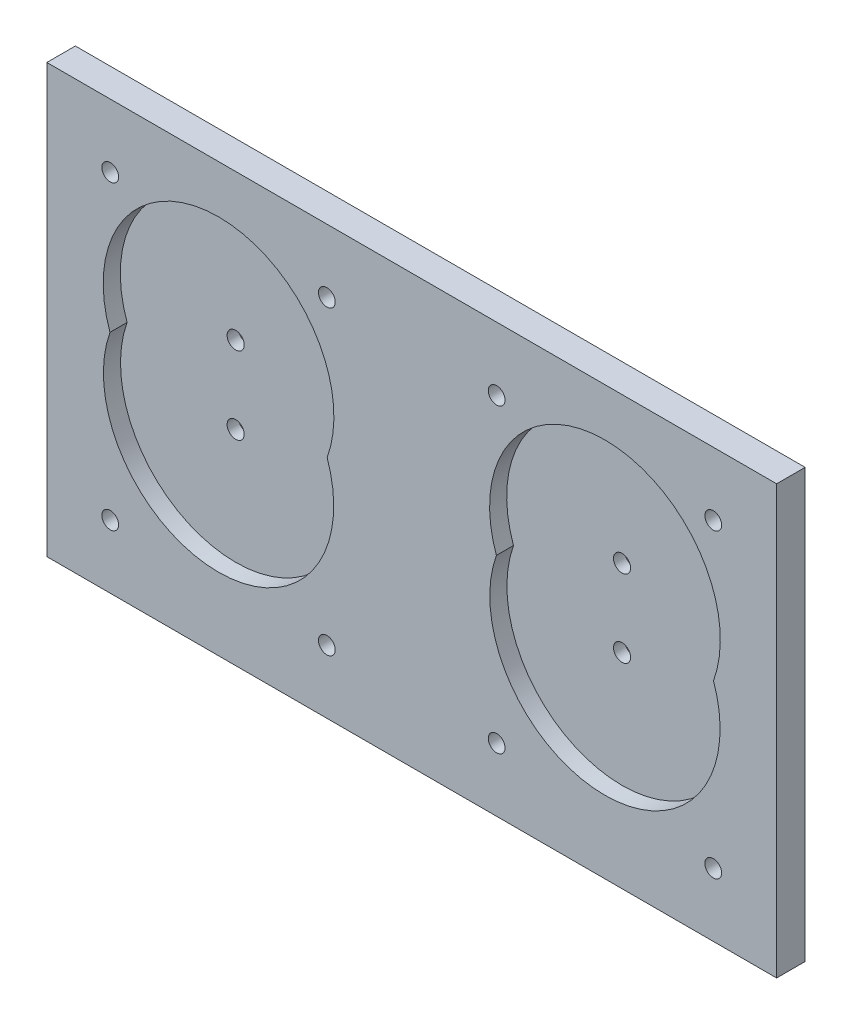
from build123d import *

# Parameters (mm, degrees)
SKETCH1_W           = 64.012274628
SKETCH1_H           = 75.085000506
BOSS_EXTRUDE1_DEPTH = 5
SKETCH7_R           = 1.4732
CUT_EXTRUDE1_DEPTH  = 10
SKETCH8_R           = 1.5
BOSS_EXTRUDE2_DEPTH = 2


with BuildPart() as part:
    # Sketch1 → Boss-Extrude1 (new body)
    # profile 1 of 2: a face of its own
    with BuildSketch(Plane.XY):
        with Locations((61.398411242, 7.077500224)):
            Rectangle(SKETCH1_W, SKETCH1_H)
        with BuildLine():
            ThreePointArc((83.484398078, 2.429730903), (59.871437613, -17.479677368), (44.238109553, 9.157805497))
            ThreePointArc((44.238109553, 9.157805497), (59.81501285, 35.930775127), (83.520814038, 15.994205484))
            ThreePointArc((83.520814038, 15.994205484), (83.22114917, 12.52456978), (82.331029644, 9.157693158))
            ThreePointArc((82.331029644, 9.157693158), (83.193968093, 5.842784333), (83.484398078, 2.429730903))
        make_face(mode=Mode.SUBTRACT)
    # profile 2 of 2: a face of its own
    with BuildSketch(Plane.XY):
        with Locations((-2.613863386, 7.077500224)):
            Rectangle(SKETCH1_W, SKETCH1_H)
        with BuildLine():
            ThreePointArc((15.69984642, 2.429730903), (-7.913055331, -17.479687433), (-23.546481788, 9.157693158))
            ThreePointArc((-23.546481788, 9.157693158), (-7.969677608, 35.930764895), (15.736182375, 15.994205484))
            ThreePointArc((15.736182375, 15.994205484), (15.436527739, 12.524628574), (14.546438303, 9.157805497))
            ThreePointArc((14.546438303, 9.157805497), (15.409406369, 5.842843047), (15.69984642, 2.429730903))
        make_face(mode=Mode.SUBTRACT)
    extrude(amount=BOSS_EXTRUDE1_DEPTH)

    # Sketch7 → Cut-Extrude1 (cut)
    with BuildSketch(Plane.XY.offset(5)):
        with Locations((-23.500584488, 33.499560055)):
            Circle(SKETCH7_R)
        with Locations((14.49941543, 33.50027263)):
            Circle(SKETCH7_R)
        with Locations((-23.49959354, -19.345440441)):
            Circle(SKETCH7_R)
        with Locations((14.500406379, -19.344727866)):
            Circle(SKETCH7_R)
        with Locations((44.284829686, -19.345328379)):
            Circle(SKETCH7_R)
        with Locations((44.284150424, 33.499672122)):
            Circle(SKETCH7_R)
        with Locations((82.284150347, 33.500160568)):
            Circle(SKETCH7_R)
        with Locations((82.284829608, -19.344839933)):
            Circle(SKETCH7_R)
    extrude(amount=-CUT_EXTRUDE1_DEPTH, mode=Mode.SUBTRACT)

    # Sketch8 → Boss-Extrude2 (add)
    # profile 1 of 2: a face of its own
    with BuildSketch(Plane(origin=(0, 0, 0), x_dir=(-1, 0, 0), z_dir=(0, 0, -1))):
        with BuildLine():
            ThreePointArc((-44.238109553, 9.157805497), (-63.284649438, 36.230429762), (-82.331029644, 9.157693158))
            ThreePointArc((-82.331029644, 9.157693158), (-63.284490186, -17.770117418), (-44.238109553, 9.157805497))
        make_face()
        with Locations((-63.284549757, 2.429730903)):
            Circle(SKETCH8_R, mode=Mode.SUBTRACT)
        with Locations((-63.28458976, 15.994205484)):
            Circle(SKETCH8_R, mode=Mode.SUBTRACT)
    # profile 2 of 2: a face of its own
    with BuildSketch(Plane(origin=(0, 0, 0), x_dir=(-1, 0, 0), z_dir=(0, 0, -1))):
        with BuildLine():
            ThreePointArc((23.546481788, 9.157693158), (4.500101582, 36.230429762), (-14.546438303, 9.157805497))
            ThreePointArc((-14.546438303, 9.157805497), (4.49994233, -17.770117418), (23.546481788, 9.157693158))
        make_face()
        with Locations((4.500041904, 15.994205484)):
            Circle(SKETCH8_R, mode=Mode.SUBTRACT)
        with Locations((4.500001901, 2.429730903)):
            Circle(SKETCH8_R, mode=Mode.SUBTRACT)
    extrude(amount=-BOSS_EXTRUDE2_DEPTH)


solid = part.part
